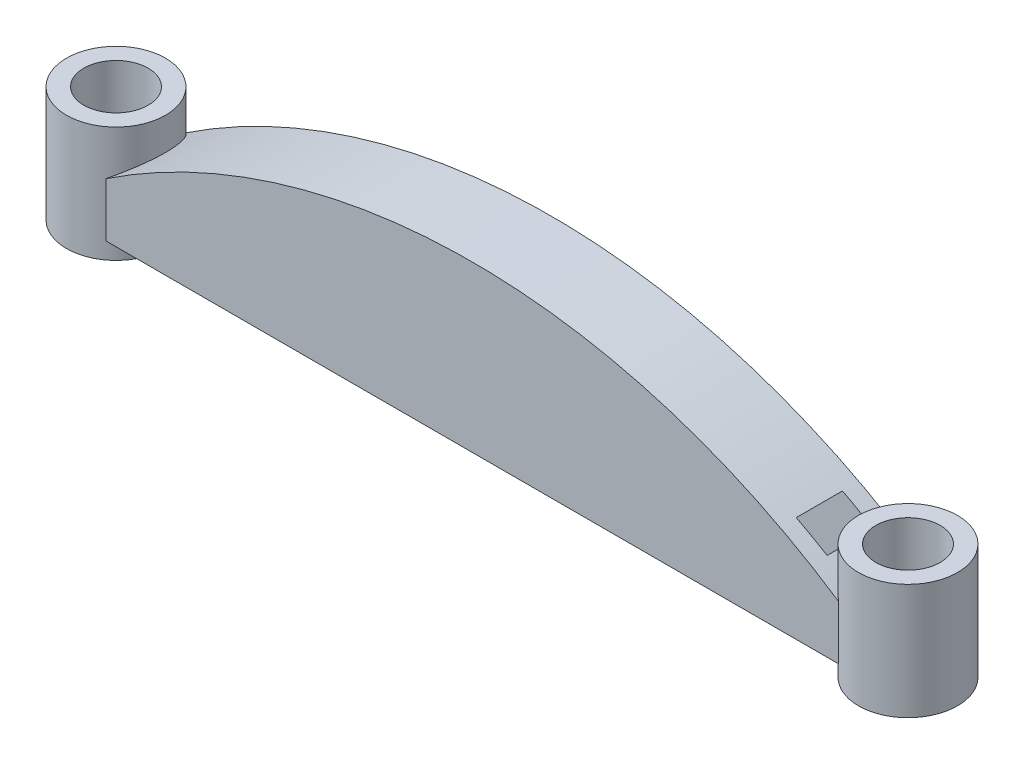
from build123d import *

# Parameters (mm, degrees)
EXTRUDE_2_DEPTH              = 12
EXTRUDE_3_DEPTH              = 5
EXTRUDE_3_DEPTH_BACK         = 30
SKETCH_4_R                   = 15
CUT_EXTRUDE_2_REACH          = 146.741
CUT_EXTRUDE_2_END_RADIUS     = 195
SKETCH_5_W                   = 30
SKETCH_5_H                   = 14
PATTERN_LINEAR_1_COUNT       = 6
PATTERN_LINEAR_1_PITCH       = 35
HOLE_WIZARD_M221_D           = 19.5
HOLE_WIZARD_M221_CSINK_D     = 24.5
HOLE_WIZARD_M221_CSINK_ANGLE = 90


with BuildPart() as part:
    # Эскиз2 → Бобышка-Вытянуть2 (new, symmetric)
    with BuildSketch(Plane.XY):
        with BuildLine():
            Line((120, 0), (-120, 0))
            Line((-120, 0), (-120, 10))
            ThreePointArc((-120, 10), (0, 50), (120, 10))
            Line((120, 10), (120, 0))
        make_face()
    extrude(amount=EXTRUDE_2_DEPTH, both=True)

    # Эскиз4 → Бобышка-Вытянуть3 (add, two sides: drawn at the far end of the back side and taken through both)
    with BuildSketch(Plane.XZ.offset(-EXTRUDE_3_DEPTH_BACK)):
        with Locations((-120, 0)):
            Circle(SKETCH_4_R)
        with Locations(Location((120, 0, 0), (0, 0, 180))):
            Circle(SKETCH_4_R)
    extrude(amount=EXTRUDE_3_DEPTH + EXTRUDE_3_DEPTH_BACK)

    # Вырез-Вытянуть2: up to this cylinder (the profile starts inside it)
    cut_extrude_2_end = Plane(origin=(0, -150, 0), z_dir=(0, 0, -1)) * Cylinder(CUT_EXTRUDE_2_END_RADIUS, 684.482, mode=Mode.PRIVATE)
    # Эскиз5 → Вырез-Вытянуть2 (cut, up to the surface)
    with BuildSketch(Plane.XZ, mode=Mode.PRIVATE) as cut_extrude_2_sk1:
        with Locations((-87.5, 0)):
            Rectangle(SKETCH_5_W, SKETCH_5_H)
    cut_extrude_2_tool1 = extrude(cut_extrude_2_sk1.sketch, amount=-CUT_EXTRUDE_2_REACH, mode=Mode.PRIVATE) & cut_extrude_2_end
    cut_extrude_2 = cut_extrude_2_tool1.solids().sort_by_distance((-87.5, 0, 0))[0]
    add(cut_extrude_2, mode=Mode.SUBTRACT)

    # Линейный массив1: Вырез-Вытянуть2 ×6
    with Locations(*[(i * PATTERN_LINEAR_1_PITCH, 0, 0) for i in range(1, PATTERN_LINEAR_1_COUNT)]):
        add(cut_extrude_2, mode=Mode.SUBTRACT)

    # Отверстие обработанное метчиком M221 (through all)
    with Locations(Plane(origin=(0, -5, 0), x_dir=(-1, 0, 0), z_dir=(0, -1, 0))):
        with Locations((-120, 0), (120, 0)):
            CounterSinkHole(HOLE_WIZARD_M221_D / 2, HOLE_WIZARD_M221_CSINK_D / 2, counter_sink_angle=HOLE_WIZARD_M221_CSINK_ANGLE)


solid = part.part
